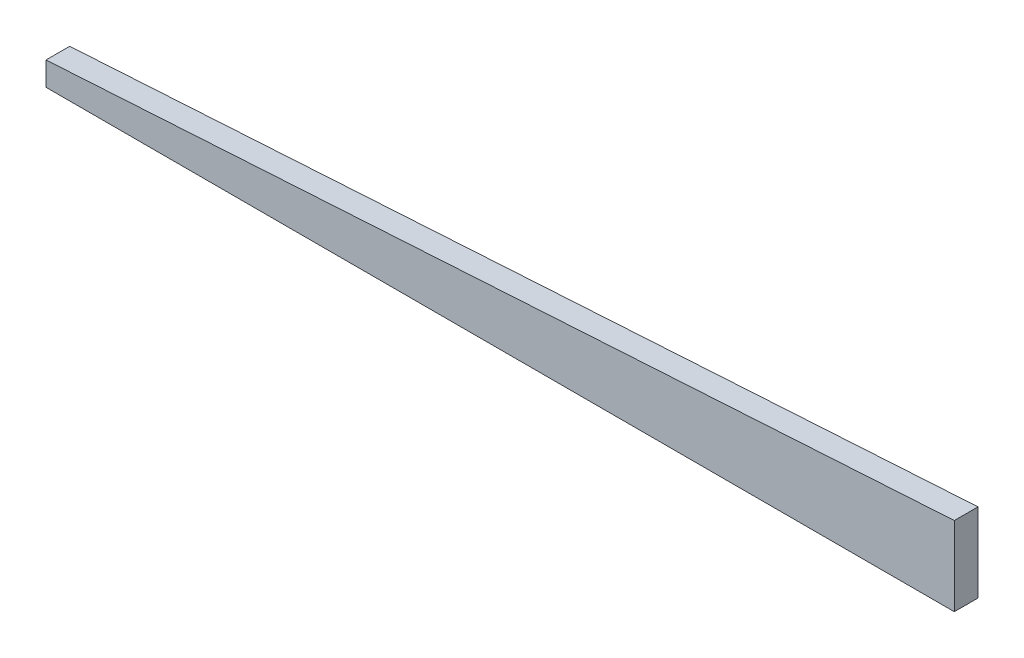
from build123d import *

# Parameters (mm, degrees)
BOSS_EXTRUDE1_DEPTH = 3


with BuildPart() as part:
    # Sketch1 → Boss-Extrude1 (new body)
    with BuildSketch(Plane.XY):
        Polygon((0, 0), (-115, 0), (-115, 3), (0, 10), align=None)
    extrude(amount=BOSS_EXTRUDE1_DEPTH)


solid = part.part
